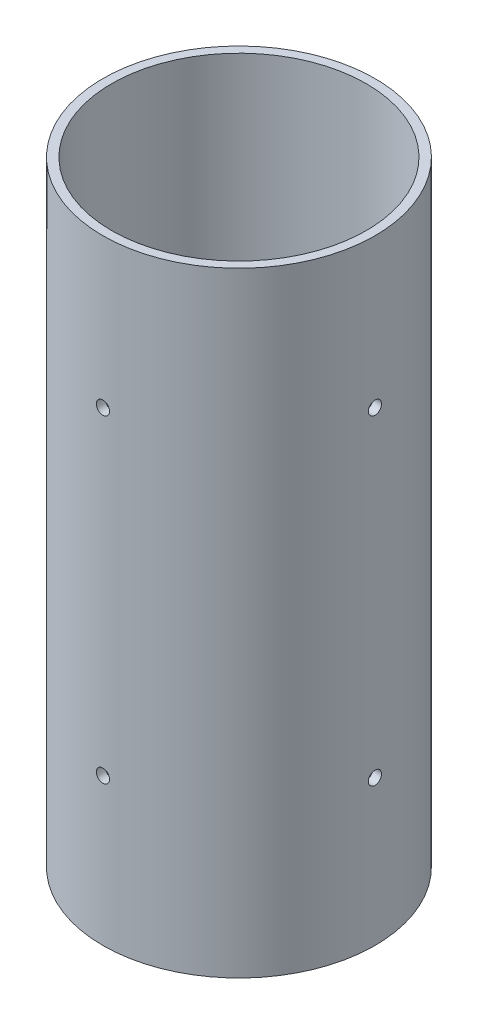
from build123d import *

# Parameters (mm, degrees)
SKETCH1_R               = 31
SKETCH1_R_2             = 29
BOSS_EXTRUDE1_DEPTH     = 140
CUT_EXTRUDE1_DEPTH      = 147.703783182
CUT_EXTRUDE1_DEPTH_BACK = 147.703783182
SKETCH2_R               = 1.5
CUT_EXTRUDE2_DEPTH      = 147.703783323
CUT_EXTRUDE2_DEPTH_BACK = 147.703783323
SKETCH3_R               = 1.5


with BuildPart() as part:
    # Sketch1 → Boss-Extrude1 (new body)
    with BuildSketch(Plane(origin=(0, 0, 0), x_dir=(1, 0, 0), z_dir=(0, 1, 0))):
        with Locations(Location((0, 0, 0), (0, 0, 270))):
            Circle(SKETCH1_R)
        with Locations(Location((0, 0, 0), (0, 0, 270))):
            Circle(SKETCH1_R_2, mode=Mode.SUBTRACT)
    extrude(amount=BOSS_EXTRUDE1_DEPTH)

    # Sketch2 → Cut-Extrude1 (cut, two sides: drawn at the far end of the back side and taken through both)
    with BuildSketch(Plane(origin=(0, 0, 0), x_dir=(0, 0, -1), z_dir=(1, 0, 0)).offset(-CUT_EXTRUDE1_DEPTH_BACK)):
        with Locations((0, 33.088409151)):
            Circle(SKETCH2_R)
        with Locations((0, 106.088409151)):
            Circle(SKETCH2_R)
    extrude(amount=CUT_EXTRUDE1_DEPTH + CUT_EXTRUDE1_DEPTH_BACK, mode=Mode.SUBTRACT)

    # Sketch3 → Cut-Extrude2 (cut, two sides: drawn at the far end of the back side and taken through both)
    with BuildSketch(Plane.XY.offset(-CUT_EXTRUDE2_DEPTH_BACK)):
        with Locations((0, 106.088379232)):
            Circle(SKETCH3_R)
        with Locations((0, 33.5)):
            Circle(SKETCH3_R)
    extrude(amount=CUT_EXTRUDE2_DEPTH + CUT_EXTRUDE2_DEPTH_BACK, mode=Mode.SUBTRACT)


solid = part.part
